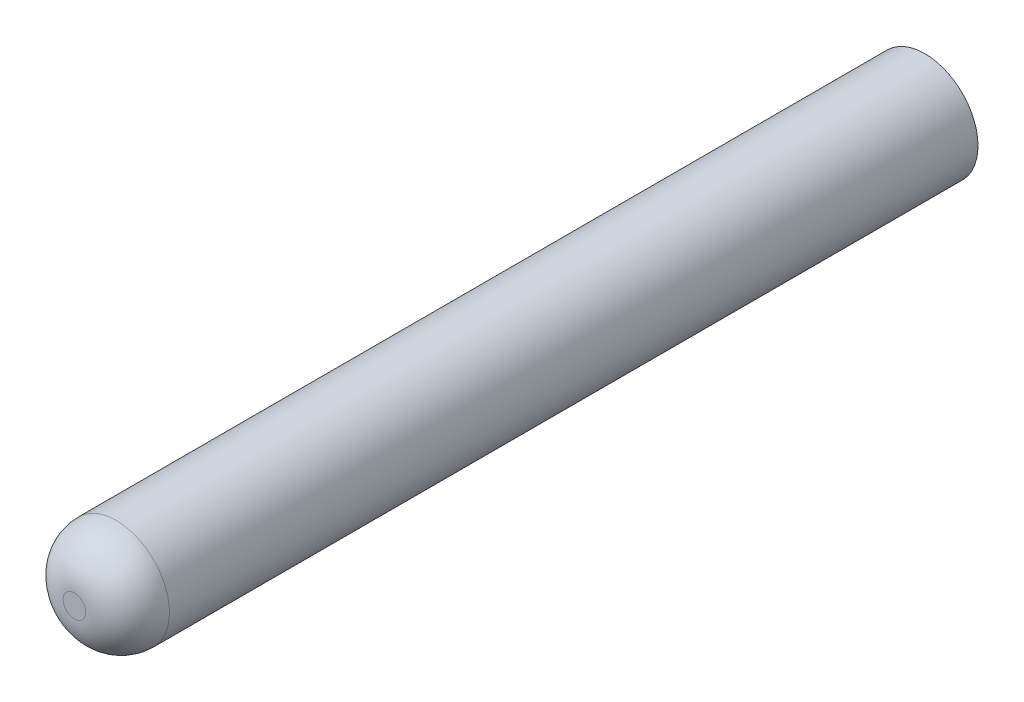
from build123d import *

# Parameters (mm, degrees)
SKETCH2_R           = 12.7
BOSS_EXTRUDE1_DEPTH = 203.2
FILLET1_R           = 10


with BuildPart() as part:
    # Sketch2 → Boss-Extrude1 (new body)
    with BuildSketch(Plane.XY):
        Circle(SKETCH2_R)
    extrude(amount=BOSS_EXTRUDE1_DEPTH)

    # Fillet1
    fillet1_edges = [part.edges().sort_by_distance(p)[0] for p in [
        (-12.7, 0, 203.2),
    ]]
    fillet(fillet1_edges, radius=FILLET1_R)


solid = part.part
